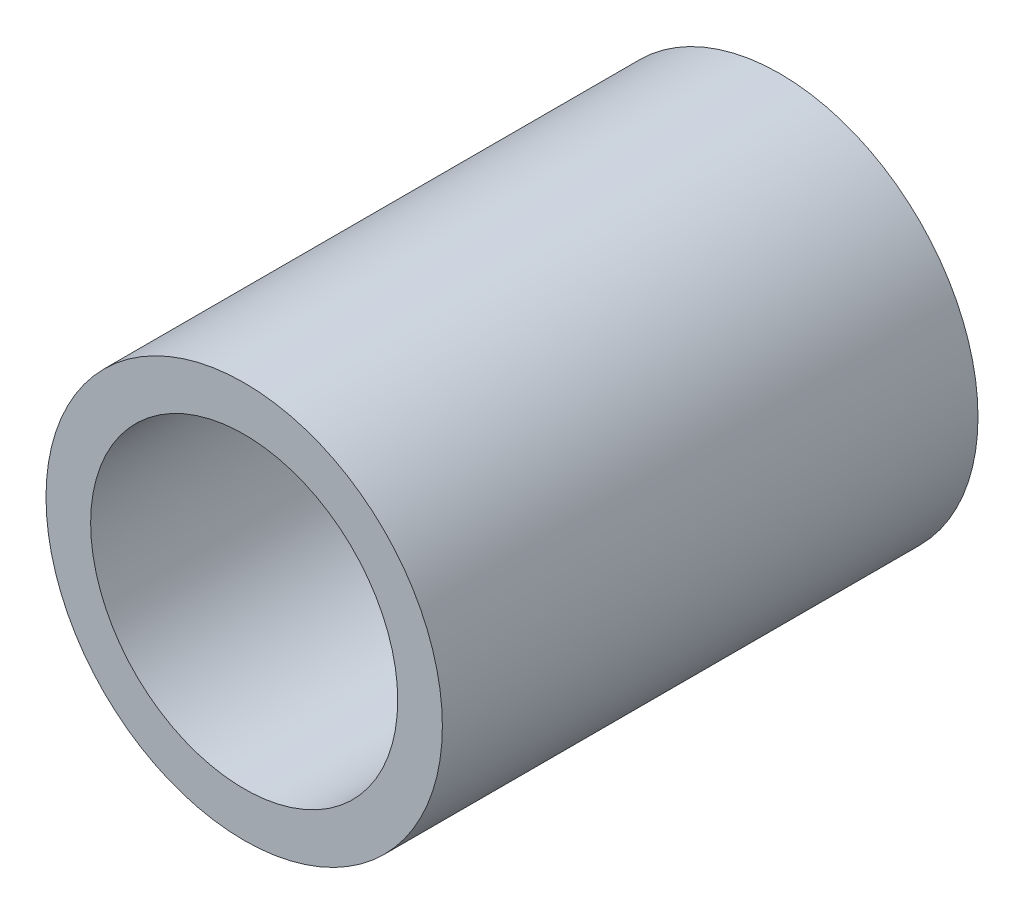
from build123d import *

# Parameters (mm, degrees)
SKETCH1_R           = 22.2
SKETCH1_R_2         = 17.2
BOSS_EXTRUDE1_DEPTH = 60


with BuildPart() as part:
    # Sketch1 → Boss-Extrude1 (new body)
    with BuildSketch(Plane.XY):
        Circle(SKETCH1_R)
        Circle(SKETCH1_R_2, mode=Mode.SUBTRACT)
    extrude(amount=BOSS_EXTRUDE1_DEPTH)


solid = part.part
